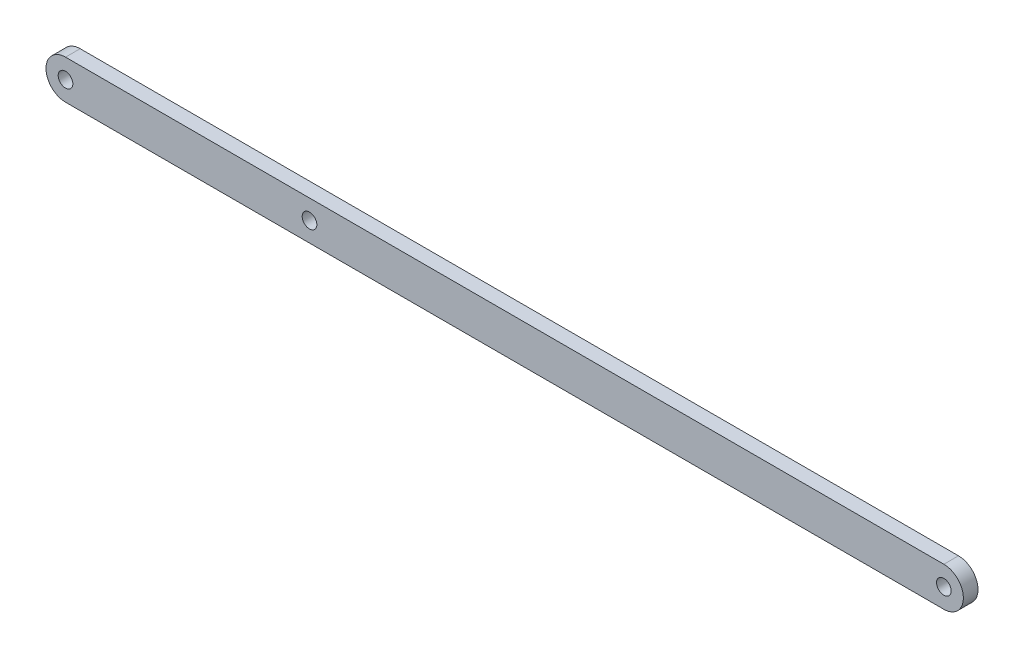
from build123d import *

# Parameters (mm, degrees)
SKETCH1_R           = 3
BOSS_EXTRUDE1_DEPTH = 6
SCALE1_SCALE        = 0.5


with BuildPart() as part:
    # Sketch1 → Boss-Extrude1 (new body)
    with BuildSketch(Plane.XY):
        with BuildLine():
            Line((-180, 8), (180, 8))
            ThreePointArc((180, 8), (188, 0), (180, -8))
            Line((180, -8), (-180, -8))
            ThreePointArc((-180, -8), (-188, 0), (-180, 8))
        make_face()
        with Locations((-180, 0)):
            Circle(SKETCH1_R, mode=Mode.SUBTRACT)
        with Locations((-80, 0)):
            Circle(SKETCH1_R, mode=Mode.SUBTRACT)
        with Locations((180, 0)):
            Circle(SKETCH1_R, mode=Mode.SUBTRACT)
    extrude(amount=-BOSS_EXTRUDE1_DEPTH)


with BuildPart() as part_1:
    # Scale1: scaled about (0.384931031, 0, -3)
    add(part.part.scale(SCALE1_SCALE).moved(Location((0.192465515, 0, -1.5))))


solid = part_1.part
